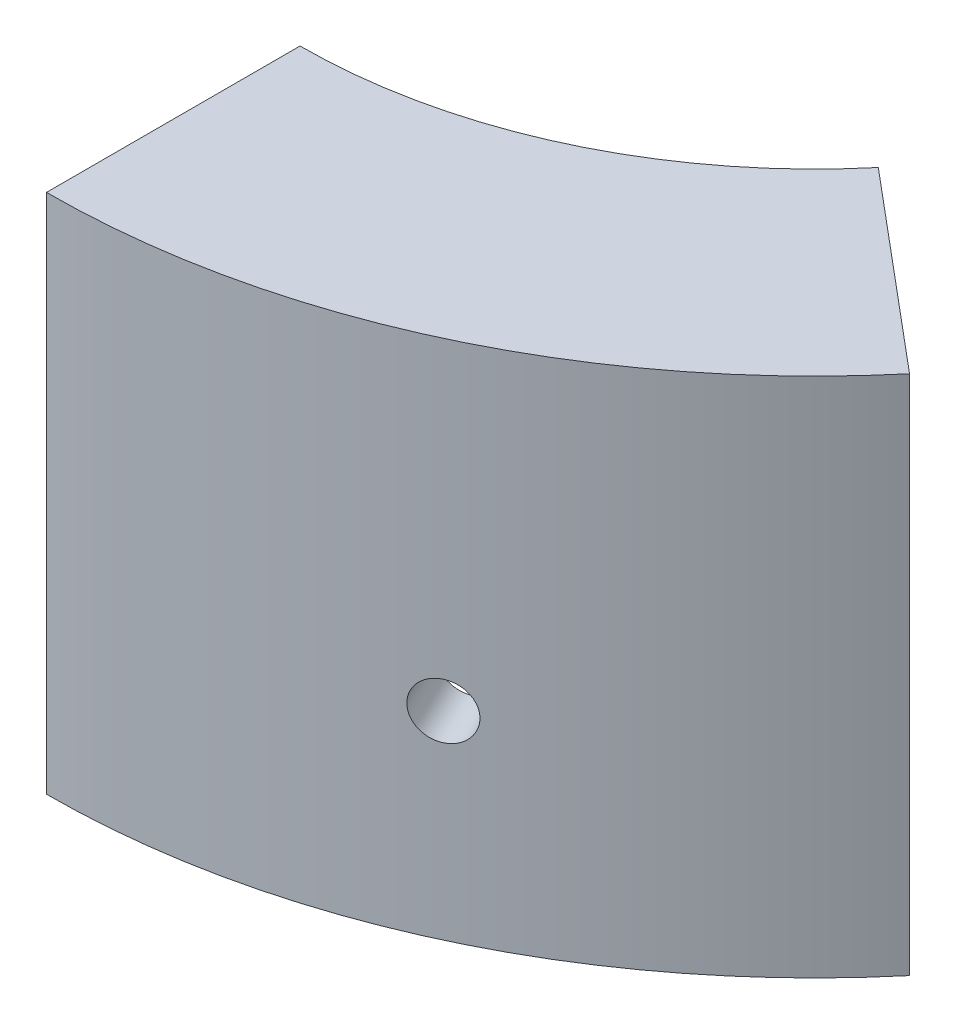
from build123d import *

# Parameters (mm, degrees)
BOSS_EXTRUDE1_DEPTH   = 6.25
BOSS_EXTRUDE2_DEPTH   = 5
BOSS_EXTRUDE3_START   = 35.7
BOSS_EXTRUDE3_DEPTH   = 35.7
SKETCH4_R             = 2.15
M4_THROUGH_HOLE_DEPTH = 51.293648181


with BuildPart() as part:
    # Sketch1 → Boss-Extrude1 (new body)
    with BuildSketch(Plane(origin=(0, 0, 0), x_dir=(1, 0, 0), z_dir=(0, 1, 0))):
        with BuildLine():
            ThreePointArc((33.093119943, -27.768424738), (18.257108907, -39.1524964), (0, -43.2))
            Line((0, -43.2), (0, -46.8))
            ThreePointArc((0, -46.8), (19.778534649, -42.415204433), (35.850879938, -30.082460133))
            Line((35.850879938, -30.082460133), (33.093119943, -27.768424738))
        make_face()
    extrude(amount=BOSS_EXTRUDE1_DEPTH)

    # Sketch2 → Boss-Extrude2 (add)
    with BuildSketch(Plane(origin=(0, 6.25, 0), x_dir=(1, 0, 0), z_dir=(0, 1, 0))):
        with BuildLine():
            ThreePointArc((35.850879938, -30.082460133), (19.778534649, -42.415204433), (0, -46.8))
            Line((0, -46.8), (0, -60))
            ThreePointArc((0, -60), (25.357095704, -54.378467222), (45.962666587, -38.567256581))
            Line((45.962666587, -38.567256581), (35.850879938, -30.082460133))
        make_face()
        with BuildLine():
            Line((35.850879938, -30.082460133), (33.093119943, -27.768424738))
            ThreePointArc((33.093119943, -27.768424738), (18.257108907, -39.1524964), (0, -43.2))
            Line((0, -43.2), (0, -46.8))
            ThreePointArc((0, -46.8), (19.778534649, -42.415204433), (35.850879938, -30.082460133))
        make_face()
        with BuildLine():
            ThreePointArc((30.794986613, -25.840061909), (16.989254122, -36.433573039), (0, -40.2))
            Line((0, -40.2), (0, -43.2))
            ThreePointArc((0, -43.2), (18.257108907, -39.1524964), (33.093119943, -27.768424738))
            Line((33.093119943, -27.768424738), (30.794986613, -25.840061909))
        make_face()
    extrude(amount=BOSS_EXTRUDE2_DEPTH)

    # Sketch3 → Boss-Extrude3 (add)
    with BuildSketch(Plane(origin=(0, 6.25, 0), x_dir=(-1, 0, 0), z_dir=(0, -1, 0)).offset(BOSS_EXTRUDE3_START)):
        with BuildLine():
            ThreePointArc((0, -55.2), (-23.328528048, -50.028189844), (-42.28565326, -35.481876055))
            Line((-42.28565326, -35.481876055), (-45.962666587, -38.567256581))
            ThreePointArc((-45.962666587, -38.567256581), (-25.357095704, -54.378467222), (0, -60))
            Line((0, -60), (0, -55.2))
        make_face()
    extrude(amount=-BOSS_EXTRUDE3_DEPTH)

    # Sketch4 → M4-through hole (cut, through all)
    with BuildSketch(Plane(origin=(15.397493307, 0, 33.020030955), x_dir=(0.9063077870366493, 0, -0.42261826174070105), z_dir=(0.42261826174070105, 0, 0.9063077870366493))):
        with Locations(Location((0, -13.95, 0), (0, 0, 180))):
            Circle(SKETCH4_R)
    extrude(amount=M4_THROUGH_HOLE_DEPTH, mode=Mode.SUBTRACT)


solid = part.part
